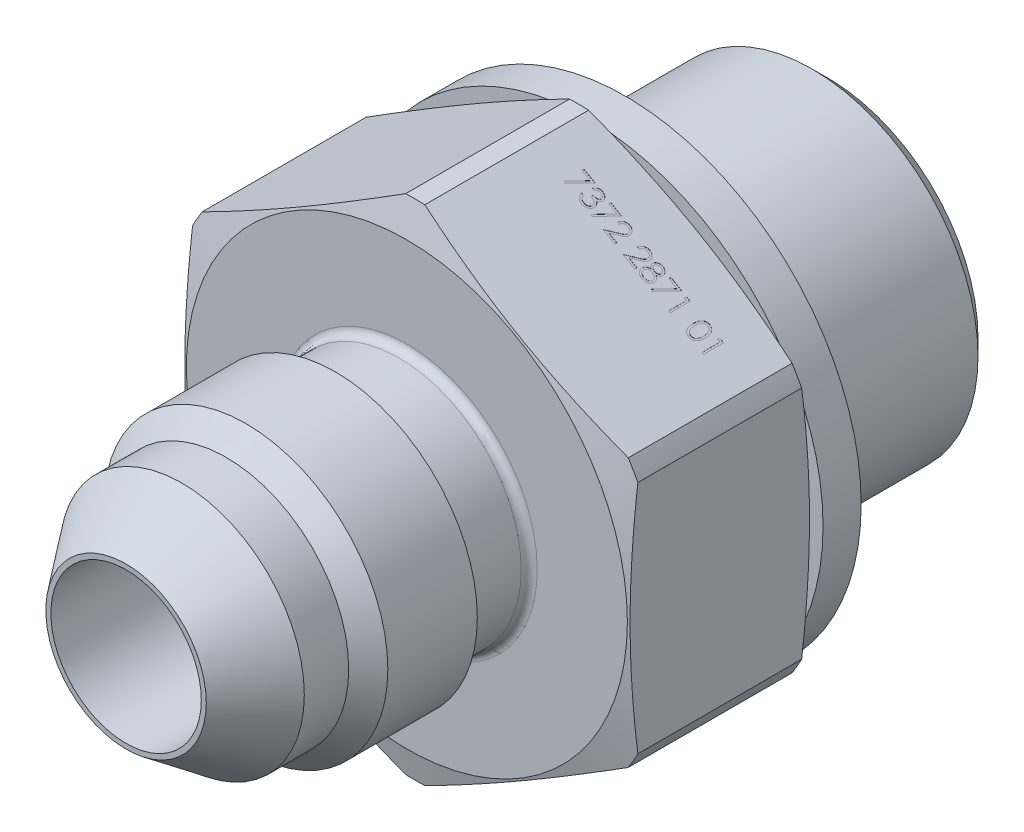
from build123d import *

# Parameters (mm, degrees)
SKETCH2_OUTSIDE_W  = 37.07
SKETCH2_OUTSIDE_H  = 37.07
EXTRUDE2_DEPTH     = 9
SKETCH3_R          = 11.75
SKETCH3_R_2        = 9.6
EXTRUDE3_DEPTH     = 1.9
CUT_EXTRUDE1_DEPTH = 0.01
SKETCH6_R          = 1.2


with BuildPart() as part:
    # Sketch1 → Revolve1 (revolve)
    with BuildSketch(Plane(origin=(0, 0, 0), x_dir=(0, 0, -1), z_dir=(1, 0, 0)), mode=Mode.PRIVATE) as revolve1_sk:
        with BuildLine():
            Line((0, 4), (2.786794125, 6.1))
            Line((2.786794125, 6.1), (5, 6.1))
            Line((5, 6.1), (5.975, 7.075))
            Line((5.975, 7.075), (10.437083488, 7.075))
            Line((10.437083488, 7.075), (11, 6.1))
            Line((11, 6.1), (13.6, 6.1))
            ThreePointArc((13.6, 6.1), (13.882842712, 6.217157288), (14, 6.5))
            Line((14, 6.5), (14, 10.99402544))
            Line((14, 10.99402544), (14.416922127, 12.55))
            Line((14.416922127, 12.55), (22.583077873, 12.55))
            Line((22.583077873, 12.55), (23, 10.99402544))
            Line((23, 10.99402544), (23, 7.25))
            Line((23, 7.25), (25.475, 7.25))
            Line((25.475, 7.25), (26.5, 8.275))
            Line((26.5, 8.275), (34.2, 8.275))
            Line((34.2, 8.275), (35, 7.475))
            Line((35, 7.475), (35, 7))
            Line((35, 7), (31.535898385, 5))
            Line((31.535898385, 5), (20.5, 5))
            Line((20.5, 5), (19.5, 3.335720518))
            Line((19.5, 3.335720518), (19.5, 1.5))
            Line((19.5, 1.5), (14.5, 1.5))
            Line((14.5, 1.5), (14.5, 3.75))
            Line((14.5, 3.75), (0, 3.75))
            Line((0, 3.75), (0, 4))
        make_face()
    revolve(revolve1_sk.sketch.rotate(Axis((0, 0, 0), (0, 0, -1)), 90), axis=Axis((0, 0, 0), (0, 0, -1)))

    # Sketch2 outside → Extrude2 (cut)
    with BuildSketch(Plane.XY.offset(-14)):
        Rectangle(SKETCH2_OUTSIDE_W, SKETCH2_OUTSIDE_H)
        Polygon((0, 12.817175976), (-11.1, 6.408587988), (-11.1, -6.408587988), (0, -12.817175976), (11.1, -6.408587988), (11.1, 6.408587988), align=None, mode=Mode.SUBTRACT)
    extrude(amount=-EXTRUDE2_DEPTH, mode=Mode.SUBTRACT)

    # Sketch5 → Cut-Extrude1 (cut)
    # profile 1 of 10: a face of its own
    with BuildSketch(Plane(origin=(5.55, 9.612881982, 0), x_dir=(0.8660254037844386, -0.5000000000000001, 0), z_dir=(0.5000000000000001, 0.8660254037844386, 0))):
        Polygon((-4.063128825, 20.809494123), (-3.44774421, 20.809494123), (-3.973385235, 19.783853097), (-4.050909274, 19.826521366), (-3.599787479, 20.70693002), (-4.063128825, 20.70693002), align=None)
    # profile 2 of 10: a face of its own
    with BuildSketch(Plane(origin=(5.55, 9.612881982, 0), x_dir=(0.8660254037844386, -0.5000000000000001, 0), z_dir=(0.5000000000000001, 0.8660254037844386, 0))):
        with BuildLine():
            Line((-3.229795492, 20.578724892), (-3.319539081, 20.578724892))
            add(Edge.make_bspline(
                [(-3.319539081, 20.578724892), (-3.317107781, 20.588791316), (-3.312354788, 20.608470352), (-3.302441196, 20.636586712), (-3.291641409, 20.663193432), (-3.278673093, 20.68779231), (-3.264527735, 20.710877711), (-3.248321243, 20.731926033), (-3.230801322, 20.751472594), (-3.211422765, 20.768819233), (-3.19110029, 20.784527156), (-3.169547542, 20.79792003), (-3.147198144, 20.809441216), (-3.123897248, 20.818932711), (-3.099575485, 20.826082861), (-3.074452736, 20.831270519), (-3.048463164, 20.834639409), (-3.030820995, 20.834968198), (-3.021862799, 20.835135149)],
                knots=[0, 0, 0, 0, 1.162005537, 2.271625781, 3.343758855, 4.383309926, 5.390229558, 6.379919256, 7.361854164, 8.333198761, 9.295911338, 10.242430842, 11.177959212, 12.116337295, 13.062827104, 14.020064771, 14.994644689, 16, 16, 16, 16], degree=3))
            add(Edge.make_bspline(
                [(-3.021862799, 20.835135149), (-3.008810587, 20.834741083), (-2.98299087, 20.833961547), (-2.945058571, 20.826843136), (-2.90847948, 20.815578813), (-2.87365398, 20.800014891), (-2.841305857, 20.780818516), (-2.812524089, 20.757971448), (-2.7876988, 20.731914505), (-2.766871835, 20.703133772), (-2.750564693, 20.672375055), (-2.738540014, 20.640717867), (-2.731219534, 20.608237304), (-2.730270804, 20.586306653), (-2.729795492, 20.575319443)],
                knots=[0, 0, 0, 0, 1.083050992, 2.142477498, 3.193116406, 4.255571735, 5.30263384, 6.308962982, 7.297363603, 8.282367274, 9.249857812, 10.179914175, 11.08814088, 12, 12, 12, 12], degree=3))
            add(Edge.make_bspline(
                [(-2.729795492, 20.575319443), (-2.730127946, 20.564746073), (-2.730778508, 20.544055629), (-2.736302424, 20.513849487), (-2.745598499, 20.485380459), (-2.758475574, 20.458528698), (-2.775144589, 20.433464458), (-2.795336788, 20.410131346), (-2.819194691, 20.388425873), (-2.837274388, 20.375991738), (-2.846582351, 20.369590277)],
                knots=[0, 0, 0, 0, 1.024540389, 2.004866551, 2.965041327, 3.920577974, 4.882998113, 5.874504559, 6.905732034, 8, 8, 8, 8], degree=3))
            add(Edge.make_bspline(
                [(-2.846582351, 20.369590277), (-2.835944706, 20.364453656), (-2.814868457, 20.354276526), (-2.786139734, 20.334317738), (-2.760060341, 20.311273067), (-2.745516421, 20.293289452), (-2.738208953, 20.284253738)],
                knots=[0, 0, 0, 0, 1.015518401, 2.012035669, 3.001164323, 4, 4, 4, 4], degree=3))
            add(Edge.make_bspline(
                [(-2.738208953, 20.284253738), (-2.733397141, 20.277665809), (-2.723852314, 20.264597833), (-2.712070733, 20.243587426), (-2.701382414, 20.222344143), (-2.69305378, 20.200298598), (-2.686604104, 20.177706309), (-2.681993809, 20.154528481), (-2.679129769, 20.130746189), (-2.678719611, 20.114656909), (-2.67851344, 20.106569443)],
                knots=[0, 0, 0, 0, 1.025084078, 2.033381695, 3.024893161, 4.013698104, 4.991890475, 5.976764909, 6.982997093, 8, 8, 8, 8], degree=3))
            add(Edge.make_bspline(
                [(-2.67851344, 20.106569443), (-2.679026158, 20.092566666), (-2.680049182, 20.064627008), (-2.689193203, 20.023348516), (-2.703368415, 19.982998373), (-2.723498968, 19.944405562), (-2.748032542, 19.908296881), (-2.777220349, 19.875989364), (-2.810730751, 19.848218335), (-2.848103794, 19.825015412), (-2.888594402, 19.806467435), (-2.931901714, 19.793593879), (-2.977401729, 19.785209308), (-3.008603814, 19.784310203), (-3.024466966, 19.783853097)],
                knots=[0, 0, 0, 0, 0.955779014, 1.907060117, 2.875433937, 3.871313158, 4.872415639, 5.851225146, 6.836215519, 7.83643374, 8.849228613, 9.86973379, 10.916971861, 12, 12, 12, 12], degree=3))
            add(Edge.make_bspline(
                [(-3.024466966, 19.783853097), (-3.035158195, 19.784101158), (-3.056194967, 19.784589259), (-3.087121681, 19.787926003), (-3.116642167, 19.79402029), (-3.144796338, 19.802221234), (-3.171609205, 19.812618875), (-3.19699895, 19.825567074), (-3.221121776, 19.840798932), (-3.243750048, 19.858494243), (-3.264881067, 19.878288911), (-3.283953274, 19.900534343), (-3.301284644, 19.924819315), (-3.316411112, 19.951425903), (-3.33002167, 19.980010262), (-3.341216229, 20.010938404), (-3.351069248, 20.043933839), (-3.355650238, 20.066927479), (-3.35800062, 20.078724892)],
                knots=[0, 0, 0, 0, 1.048658725, 2.063410685, 3.046034179, 4.001477787, 4.936774919, 5.862367409, 6.792675028, 7.730719943, 8.675894397, 9.627829632, 10.600096036, 11.597688215, 12.626045268, 13.701542398, 14.82072376, 16, 16, 16, 16], degree=3))
            Line((-3.35800062, 20.078724892), (-3.26825703, 20.078724892))
            add(Edge.make_bspline(
                [(-3.26825703, 20.078724892), (-3.265918947, 20.071025174), (-3.261371172, 20.056048554), (-3.253629944, 20.034494181), (-3.244810437, 20.014734737), (-3.235349135, 19.996625273), (-3.225412436, 19.979987444), (-3.214293886, 19.965261196), (-3.202816987, 19.951799709), (-3.194165744, 19.944215535), (-3.18993171, 19.940503738)],
                knots=[0, 0, 0, 0, 1.198163088, 2.33053128, 3.407730985, 4.417276592, 5.372219308, 6.28897303, 7.162600585, 8, 8, 8, 8], degree=3))
            add(Edge.make_bspline(
                [(-3.18993171, 19.940503738), (-3.184332688, 19.936187071), (-3.173151927, 19.927567062), (-3.154932432, 19.916566597), (-3.135771036, 19.907034876), (-3.115252558, 19.89975382), (-3.093819766, 19.893588774), (-3.071126233, 19.88955434), (-3.047372171, 19.886786291), (-3.03115281, 19.886542025), (-3.022864402, 19.8864172)],
                knots=[0, 0, 0, 0, 0.946170439, 1.889420265, 2.845303464, 3.807233317, 4.801018734, 5.828864929, 6.890507805, 8, 8, 8, 8], degree=3))
            add(Edge.make_bspline(
                [(-3.022864402, 19.8864172), (-3.013506258, 19.886593173), (-2.995207216, 19.886937273), (-2.968505828, 19.89010176), (-2.9431037, 19.89471045), (-2.919282864, 19.901828445), (-2.896731291, 19.910622974), (-2.875765105, 19.921665375), (-2.856109075, 19.93462101), (-2.838014959, 19.949346484), (-2.821744814, 19.965466911), (-2.807419239, 19.982327789), (-2.795240764, 19.999858026), (-2.785416884, 20.018154632), (-2.777659584, 20.03714184), (-2.77237867, 20.056872934), (-2.768706808, 20.077186439), (-2.768407776, 20.090994716), (-2.76825703, 20.097955661)],
                knots=[0, 0, 0, 0, 1.217147791, 2.380027433, 3.494444702, 4.572153297, 5.609568379, 6.639424714, 7.649109417, 8.668170816, 9.669597737, 10.625200337, 11.543417969, 12.441394052, 13.322311151, 14.205496177, 15.095365482, 16, 16, 16, 16], degree=3))
            add(Edge.make_bspline(
                [(-2.76825703, 20.097955661), (-2.768694259, 20.107273187), (-2.769566541, 20.125861875), (-2.776226136, 20.153209753), (-2.787180097, 20.1795593), (-2.8025151, 20.204460954), (-2.821182451, 20.227539783), (-2.843000996, 20.248131635), (-2.868151918, 20.26512309), (-2.891300452, 20.276862706), (-2.911804783, 20.284873299), (-2.929352035, 20.290209003), (-2.948996779, 20.29472719), (-2.97050145, 20.298930696), (-2.994028084, 20.302508224), (-3.019551066, 20.3054916), (-3.047075569, 20.307878755), (-3.066130188, 20.308944782), (-3.075949338, 20.309494123)],
                knots=[0, 0, 0, 0, 1.07054697, 2.135767047, 3.216561865, 4.33974944, 5.486079747, 6.621378074, 7.775625952, 8.963672916, 9.598146892, 10.304877434, 11.070270905, 11.915000392, 12.823868403, 13.805723172, 14.86925407, 16, 16, 16, 16], degree=3))
            Line((-3.075949338, 20.309494123), (-3.075949338, 20.412058225))
            add(Edge.make_bspline(
                [(-3.075949338, 20.412058225), (-3.063577576, 20.412268169), (-3.039344334, 20.412679398), (-3.003945961, 20.417653115), (-2.970096444, 20.424533295), (-2.938545946, 20.435071921), (-2.909789171, 20.447312006), (-2.884840713, 20.461555494), (-2.864050099, 20.47738828), (-2.847518365, 20.49505474), (-2.835081442, 20.514001896), (-2.825988072, 20.533749512), (-2.82061655, 20.554470673), (-2.819899502, 20.568612006), (-2.819539081, 20.575720084)],
                knots=[0, 0, 0, 0, 1.321986639, 2.589447074, 3.816329219, 5.01088745, 6.139805852, 7.153945165, 8.075214402, 8.924034688, 9.728124013, 10.488707548, 11.240355623, 12, 12, 12, 12], degree=3))
            add(Edge.make_bspline(
                [(-2.819539081, 20.575720084), (-2.819657484, 20.580942297), (-2.819893042, 20.591331642), (-2.822863693, 20.606510233), (-2.827327704, 20.621224789), (-2.83346477, 20.635412735), (-2.841679112, 20.64897567), (-2.851509394, 20.662029227), (-2.863214566, 20.674498878), (-2.876627551, 20.686121827), (-2.891030923, 20.697198752), (-2.906816573, 20.706602648), (-2.923508538, 20.714644094), (-2.941125296, 20.721275381), (-2.959724019, 20.726263749), (-2.979217321, 20.729845418), (-2.999642374, 20.732084748), (-3.013577154, 20.732407152), (-3.020660876, 20.732571046)],
                knots=[0, 0, 0, 0, 0.884392785, 1.759457502, 2.611959086, 3.489218968, 4.37281399, 5.2945488, 6.255912374, 7.266815255, 8.301784654, 9.332968512, 10.37626691, 11.440494194, 12.520033166, 13.637162961, 14.798855837, 16, 16, 16, 16], degree=3))
            add(Edge.make_bspline(
                [(-3.020660876, 20.732571046), (-3.032047067, 20.732173514), (-3.054286946, 20.731397041), (-3.086348351, 20.724596181), (-3.116153875, 20.7137453), (-3.138936351, 20.700793008), (-3.155759944, 20.68800717), (-3.167781926, 20.676840774), (-3.179587786, 20.664431396), (-3.190400837, 20.650014717), (-3.201336259, 20.634567063), (-3.211291848, 20.617303154), (-3.220966045, 20.598673327), (-3.226795345, 20.585503145), (-3.229795492, 20.578724892)],
                knots=[0, 0, 0, 0, 1.472543308, 2.876219568, 4.221790263, 5.565193594, 6.249813518, 6.953379497, 7.687249741, 8.463570142, 9.283606569, 10.136032583, 11.040678096, 12, 12, 12, 12], degree=3))
        make_face()
    # profile 3 of 10: a face of its own
    with BuildSketch(Plane(origin=(5.55, 9.612881982, 0), x_dir=(0.8660254037844386, -0.5000000000000001, 0), z_dir=(0.5000000000000001, 0.8660254037844386, 0))):
        Polygon((-2.524667286, 20.809494123), (-1.909282671, 20.809494123), (-2.434923697, 19.783853097), (-2.512447735, 19.826521366), (-2.06132594, 20.70693002), (-2.524667286, 20.70693002), align=None)
    # profile 4 of 10: a face of its own
    with BuildSketch(Plane(origin=(5.55, 9.612881982, 0), x_dir=(0.8660254037844386, -0.5000000000000001, 0), z_dir=(0.5000000000000001, 0.8660254037844386, 0))):
        with BuildLine():
            Line((-1.691333953, 20.501801815), (-1.781077543, 20.501801815))
            add(Edge.make_bspline(
                [(-1.781077543, 20.501801815), (-1.780492642, 20.513707783), (-1.779343912, 20.537090787), (-1.773964401, 20.571183332), (-1.766267008, 20.603770417), (-1.755383735, 20.634590393), (-1.741867656, 20.663915766), (-1.725659076, 20.691630056), (-1.706460833, 20.717627539), (-1.684687481, 20.741667208), (-1.661039298, 20.7637208), (-1.635523316, 20.782765155), (-1.608710451, 20.798855918), (-1.580682051, 20.812307702), (-1.55112189, 20.822404801), (-1.520298216, 20.829896698), (-1.488075606, 20.834404225), (-1.466121314, 20.834888735), (-1.454955748, 20.835135149)],
                knots=[0, 0, 0, 0, 1.10065271, 2.161652631, 3.183658789, 4.190468796, 5.17591951, 6.163126047, 7.15150782, 8.156236427, 9.156009102, 10.134482811, 11.092018607, 12.041330605, 13.001268258, 13.972401359, 14.968799086, 16, 16, 16, 16], degree=3))
            add(Edge.make_bspline(
                [(-1.454955748, 20.835135149), (-1.443990584, 20.834878447), (-1.422444428, 20.834374037), (-1.390998139, 20.830042314), (-1.361061769, 20.823257859), (-1.332693835, 20.813739169), (-1.306120674, 20.800943618), (-1.281142661, 20.785572893), (-1.25746243, 20.767795798), (-1.236146206, 20.746866137), (-1.216572469, 20.724522599), (-1.19968611, 20.700668912), (-1.185225206, 20.676031973), (-1.173171584, 20.650423916), (-1.164298401, 20.623603622), (-1.15756177, 20.595961564), (-1.153753938, 20.567211618), (-1.153169531, 20.547752602), (-1.152872415, 20.537859507)],
                knots=[0, 0, 0, 0, 1.111607364, 2.184268762, 3.212621178, 4.221274766, 5.211760367, 6.196651075, 7.1921475, 8.207485113, 9.220403448, 10.201281604, 11.166441695, 12.114753415, 13.065576456, 14.026450734, 14.996634279, 16, 16, 16, 16], degree=3))
            add(Edge.make_bspline(
                [(-1.152872415, 20.537859507), (-1.153354313, 20.523930991), (-1.154309654, 20.496318382), (-1.16255414, 20.455688566), (-1.175291882, 20.416287121), (-1.190741319, 20.38457882), (-1.206347196, 20.35915685), (-1.220112851, 20.338038096), (-1.236584952, 20.315516263), (-1.255612785, 20.291364517), (-1.276909301, 20.265508983), (-1.300627777, 20.23793905), (-1.326949403, 20.208947534), (-1.345423169, 20.189145873), (-1.354995812, 20.178885149)],
                knots=[0, 0, 0, 0, 1.184203166, 2.347625244, 3.513805382, 4.700623107, 5.337941753, 6.051866363, 6.845199593, 7.711357327, 8.668078039, 9.695487809, 10.805859518, 12, 12, 12, 12], degree=3))
            Line((-1.354995812, 20.178885149), (-1.605196133, 19.912058225))
            Line((-1.605196133, 19.912058225), (-1.140051902, 19.912058225))
            Line((-1.140051902, 19.912058225), (-1.140051902, 19.809494123))
            Line((-1.140051902, 19.809494123), (-1.819539081, 19.809494123))
            Line((-1.819539081, 19.809494123), (-1.431718569, 20.223356302))
            add(Edge.make_bspline(
                [(-1.431718569, 20.223356302), (-1.422276315, 20.233212961), (-1.404139679, 20.252145586), (-1.378487514, 20.279786432), (-1.355447803, 20.305429158), (-1.334871405, 20.329025315), (-1.317204689, 20.350920048), (-1.301526909, 20.370404249), (-1.288965311, 20.388334092), (-1.275332341, 20.409117125), (-1.262128346, 20.434492072), (-1.250781959, 20.465501698), (-1.243863431, 20.49742377), (-1.243033478, 20.518995781), (-1.242616004, 20.529846687)],
                knots=[0, 0, 0, 0, 1.329631726, 2.553950428, 3.673215718, 4.687767853, 5.603093632, 6.413772471, 7.123043292, 7.734684054, 8.834405432, 9.900288307, 10.943827018, 12, 12, 12, 12], degree=3))
            add(Edge.make_bspline(
                [(-1.242616004, 20.529846687), (-1.242797645, 20.536669944), (-1.243155624, 20.550117272), (-1.246314966, 20.569833203), (-1.251089396, 20.588851722), (-1.257930899, 20.607231327), (-1.266961396, 20.624787228), (-1.27795379, 20.641540794), (-1.290636665, 20.657737641), (-1.305308457, 20.672924297), (-1.321426034, 20.686833213), (-1.338452962, 20.69915438), (-1.356467278, 20.709451269), (-1.375393027, 20.717892268), (-1.395177447, 20.724513806), (-1.415858802, 20.729101971), (-1.43737995, 20.731982681), (-1.452075234, 20.732372445), (-1.45956312, 20.732571046)],
                knots=[0, 0, 0, 0, 0.991446411, 1.95395049, 2.89581595, 3.838931463, 4.798493298, 5.75982156, 6.748411868, 7.785213223, 8.824556874, 9.840280684, 10.836137867, 11.835679398, 12.848801643, 13.863922112, 14.911575587, 16, 16, 16, 16], degree=3))
            add(Edge.make_bspline(
                [(-1.45956312, 20.732571046), (-1.467383358, 20.732366751), (-1.482741014, 20.73196555), (-1.505289309, 20.729159074), (-1.526799531, 20.724317405), (-1.547325789, 20.717695498), (-1.566902814, 20.70927877), (-1.585435398, 20.698795415), (-1.602881937, 20.686285845), (-1.61927523, 20.672102829), (-1.634379224, 20.656312086), (-1.64764976, 20.638709239), (-1.659245192, 20.619615692), (-1.669362116, 20.599082963), (-1.677578028, 20.57692474), (-1.683856071, 20.553219682), (-1.688823741, 20.528070716), (-1.690483318, 20.510703549), (-1.691333953, 20.501801815)],
                knots=[0, 0, 0, 0, 1.031018746, 2.02475058, 2.990194455, 3.934040569, 4.864654155, 5.795059489, 6.735614925, 7.690564532, 8.649604399, 9.611025574, 10.590972636, 11.591080095, 12.624614302, 13.701020113, 14.821632451, 16, 16, 16, 16], degree=3))
        make_face()
    # profile 5 of 10: a face of its own
    with BuildSketch(Plane(origin=(5.55, 9.612881982, 0), x_dir=(0.8660254037844386, -0.5000000000000001, 0), z_dir=(0.5000000000000001, 0.8660254037844386, 0))):
        with BuildLine():
            Line((-0.537487799, 20.501801815), (-0.627231389, 20.501801815))
            add(Edge.make_bspline(
                [(-0.627231389, 20.501801815), (-0.626646488, 20.513707783), (-0.625497758, 20.537090787), (-0.620118247, 20.571183332), (-0.612420854, 20.603770417), (-0.601537581, 20.634590393), (-0.588021502, 20.663915766), (-0.571812923, 20.691630056), (-0.55261468, 20.717627539), (-0.530841327, 20.741667208), (-0.507193144, 20.7637208), (-0.481677162, 20.782765155), (-0.454864297, 20.798855918), (-0.426835897, 20.812307702), (-0.397275736, 20.822404801), (-0.366452062, 20.829896698), (-0.334229452, 20.834404225), (-0.31227516, 20.834888735), (-0.301109594, 20.835135149)],
                knots=[0, 0, 0, 0, 1.10065271, 2.161652631, 3.183658789, 4.190468796, 5.17591951, 6.163126047, 7.15150782, 8.156236427, 9.156009102, 10.134482811, 11.092018607, 12.041330605, 13.001268258, 13.972401359, 14.968799086, 16, 16, 16, 16], degree=3))
            add(Edge.make_bspline(
                [(-0.301109594, 20.835135149), (-0.29014443, 20.834878447), (-0.268598275, 20.834374037), (-0.237151985, 20.830042314), (-0.207215615, 20.823257859), (-0.178847682, 20.813739169), (-0.15227452, 20.800943618), (-0.127296507, 20.785572893), (-0.103616276, 20.767795798), (-0.082300052, 20.746866137), (-0.062726315, 20.724522599), (-0.045839956, 20.700668912), (-0.031379053, 20.676031973), (-0.01932543, 20.650423916), (-0.010452247, 20.623603622), (-0.003715616, 20.595961564), (9.2216e-05, 20.567211618), (0.000676623, 20.547752602), (0.000973739, 20.537859507)],
                knots=[0, 0, 0, 0, 1.111607364, 2.184268762, 3.212621178, 4.221274766, 5.211760367, 6.196651075, 7.1921475, 8.207485113, 9.220403448, 10.201281604, 11.166441695, 12.114753415, 13.065576456, 14.026450734, 14.996634279, 16, 16, 16, 16], degree=3))
            add(Edge.make_bspline(
                [(0.000973739, 20.537859507), (0.000491841, 20.523930991), (-0.0004635, 20.496318382), (-0.008707986, 20.455688566), (-0.021445728, 20.416287121), (-0.036895165, 20.38457882), (-0.052501042, 20.35915685), (-0.066266698, 20.338038096), (-0.082738798, 20.315516263), (-0.101766631, 20.291364517), (-0.123063147, 20.265508983), (-0.146781623, 20.23793905), (-0.173103249, 20.208947534), (-0.191577015, 20.189145873), (-0.201149658, 20.178885149)],
                knots=[0, 0, 0, 0, 1.184203166, 2.347625244, 3.513805382, 4.700623107, 5.337941753, 6.051866363, 6.845199593, 7.711357327, 8.668078039, 9.695487809, 10.805859518, 12, 12, 12, 12], degree=3))
            Line((-0.201149658, 20.178885149), (-0.451349979, 19.912058225))
            Line((-0.451349979, 19.912058225), (0.013794252, 19.912058225))
            Line((0.013794252, 19.912058225), (0.013794252, 19.809494123))
            Line((0.013794252, 19.809494123), (-0.665692927, 19.809494123))
            Line((-0.665692927, 19.809494123), (-0.277872415, 20.223356302))
            add(Edge.make_bspline(
                [(-0.277872415, 20.223356302), (-0.268430161, 20.233212961), (-0.250293525, 20.252145586), (-0.22464136, 20.279786432), (-0.201601649, 20.305429158), (-0.181025251, 20.329025315), (-0.163358535, 20.350920048), (-0.147680755, 20.370404249), (-0.135119157, 20.388334092), (-0.121486187, 20.409117125), (-0.108282193, 20.434492072), (-0.096935805, 20.465501698), (-0.090017277, 20.49742377), (-0.089187324, 20.518995781), (-0.088769851, 20.529846687)],
                knots=[0, 0, 0, 0, 1.329631726, 2.553950428, 3.673215718, 4.687767853, 5.603093632, 6.413772471, 7.123043292, 7.734684054, 8.834405432, 9.900288307, 10.943827018, 12, 12, 12, 12], degree=3))
            add(Edge.make_bspline(
                [(-0.088769851, 20.529846687), (-0.088951491, 20.536669944), (-0.08930947, 20.550117272), (-0.092468812, 20.569833203), (-0.097243243, 20.588851722), (-0.104084745, 20.607231327), (-0.113115242, 20.624787228), (-0.124107636, 20.641540794), (-0.136790512, 20.657737641), (-0.151462303, 20.672924297), (-0.16757988, 20.686833213), (-0.184606808, 20.69915438), (-0.202621124, 20.709451269), (-0.221546873, 20.717892268), (-0.241331293, 20.724513806), (-0.262012649, 20.729101971), (-0.283533796, 20.731982681), (-0.298229081, 20.732372445), (-0.305716966, 20.732571046)],
                knots=[0, 0, 0, 0, 0.991446411, 1.95395049, 2.89581595, 3.838931463, 4.798493298, 5.75982156, 6.748411868, 7.785213223, 8.824556874, 9.840280684, 10.836137867, 11.835679398, 12.848801643, 13.863922112, 14.911575587, 16, 16, 16, 16], degree=3))
            add(Edge.make_bspline(
                [(-0.305716966, 20.732571046), (-0.313537204, 20.732366751), (-0.32889486, 20.73196555), (-0.351443155, 20.729159074), (-0.372953377, 20.724317405), (-0.393479635, 20.717695498), (-0.41305666, 20.70927877), (-0.431589244, 20.698795415), (-0.449035784, 20.686285845), (-0.465429076, 20.672102829), (-0.48053307, 20.656312086), (-0.493803606, 20.638709239), (-0.505399039, 20.619615692), (-0.515515962, 20.599082963), (-0.523731874, 20.57692474), (-0.530009917, 20.553219682), (-0.534977587, 20.528070716), (-0.536637165, 20.510703549), (-0.537487799, 20.501801815)],
                knots=[0, 0, 0, 0, 1.031018746, 2.02475058, 2.990194455, 3.934040569, 4.864654155, 5.795059489, 6.735614925, 7.690564532, 8.649604399, 9.611025574, 10.590972636, 11.591080095, 12.624614302, 13.701020113, 14.821632451, 16, 16, 16, 16], degree=3))
        make_face()
    # profile 6 of 10: a face of its own
    with BuildSketch(Plane(origin=(5.55, 9.612881982, 0), x_dir=(0.8660254037844386, -0.5000000000000001, 0), z_dir=(0.5000000000000001, 0.8660254037844386, 0))):
        with BuildLine():
            add(Edge.make_bspline(
                [(0.589715726, 20.366585469), (0.597901026, 20.362317482), (0.613865093, 20.353993481), (0.636601438, 20.340590387), (0.65738001, 20.326464397), (0.676777313, 20.312282723), (0.694452556, 20.297502251), (0.710208103, 20.282064207), (0.724433137, 20.266353937), (0.736840789, 20.250105411), (0.747754171, 20.233361797), (0.75718621, 20.216079147), (0.765248268, 20.198295338), (0.771637679, 20.179816243), (0.776901048, 20.160913311), (0.780522649, 20.14134246), (0.78247034, 20.121232648), (0.782838573, 20.107641705), (0.783025021, 20.100760149)],
                knots=[0, 0, 0, 0, 1.272397273, 2.481599622, 3.635517121, 4.734568067, 5.792894095, 6.808321871, 7.773003508, 8.711915296, 9.623354172, 10.525449501, 11.423591555, 12.311487226, 13.218079475, 14.126165749, 15.051214107, 16, 16, 16, 16], degree=3))
            add(Edge.make_bspline(
                [(0.783025021, 20.100760149), (0.782804615, 20.091132225), (0.782368349, 20.072074952), (0.778568354, 20.043947491), (0.772878932, 20.016629839), (0.7645705, 19.990127985), (0.753795245, 19.964588164), (0.740516149, 19.939988514), (0.725484376, 19.915925854), (0.713412308, 19.901120311), (0.707303867, 19.893628738)],
                knots=[0, 0, 0, 0, 1.025265484, 2.029385089, 3.018602448, 3.995076438, 4.983346944, 5.966715145, 6.97116228, 8, 8, 8, 8], degree=3))
            add(Edge.make_bspline(
                [(0.707303867, 19.893628738), (0.699350589, 19.88488766), (0.683542313, 19.867513519), (0.656461477, 19.844956145), (0.626740938, 19.825999175), (0.594495701, 19.810550062), (0.559811957, 19.798525531), (0.522697099, 19.789884812), (0.483078769, 19.784935546), (0.455848635, 19.784220121), (0.441879188, 19.783853097)],
                knots=[0, 0, 0, 0, 0.954267603, 1.896743057, 2.838368354, 3.796610408, 4.779680527, 5.799409237, 6.871065594, 8, 8, 8, 8], degree=3))
            add(Edge.make_bspline(
                [(0.441879188, 19.783853097), (0.428446791, 19.784182377), (0.402308711, 19.784823121), (0.364263604, 19.789164387), (0.328799869, 19.796772349), (0.295711307, 19.807185095), (0.265197395, 19.820730874), (0.23734508, 19.837590419), (0.211752516, 19.857085117), (0.189196381, 19.879774854), (0.169171111, 19.904077103), (0.151580239, 19.929148992), (0.136959074, 19.954992808), (0.124579904, 19.981223199), (0.115103326, 20.008207814), (0.108539837, 20.035807818), (0.104371462, 20.063975001), (0.103816852, 20.082984045), (0.103537842, 20.092547007)],
                knots=[0, 0, 0, 0, 1.256902934, 2.445805442, 3.576955095, 4.645999104, 5.686449165, 6.692658513, 7.68621702, 8.689161843, 9.678783111, 10.630372946, 11.551080876, 12.453998257, 13.34127905, 14.221779781, 15.105423033, 16, 16, 16, 16], degree=3))
            add(Edge.make_bspline(
                [(0.103537842, 20.092547007), (0.103702951, 20.09956392), (0.104029264, 20.113431814), (0.106287792, 20.133920194), (0.109918781, 20.153861947), (0.114850054, 20.173330731), (0.121533205, 20.192184808), (0.129602386, 20.210513515), (0.139011515, 20.228337543), (0.149891848, 20.245754367), (0.162549569, 20.262519942), (0.17688204, 20.278918797), (0.193175717, 20.294696473), (0.211249334, 20.310045738), (0.230896345, 20.325238873), (0.252627068, 20.339454796), (0.27586543, 20.353699928), (0.292381261, 20.362216593), (0.300853547, 20.366585469)],
                knots=[0, 0, 0, 0, 0.941657376, 1.861047343, 2.762797495, 3.66048619, 4.553285746, 5.444104102, 6.34607688, 7.256116206, 8.197091036, 9.162375105, 10.176350973, 11.237807142, 12.343728897, 13.50695164, 14.721116704, 16, 16, 16, 16], degree=3))
            add(Edge.make_bspline(
                [(0.300853547, 20.366585469), (0.289256011, 20.372909689), (0.266799936, 20.385155148), (0.23706581, 20.407654235), (0.211525632, 20.432022182), (0.190881427, 20.458773552), (0.174632219, 20.487072659), (0.163484046, 20.516742446), (0.155942194, 20.547232764), (0.1551951, 20.568063106), (0.154819893, 20.578524572)],
                knots=[0, 0, 0, 0, 1.166880483, 2.259407225, 3.286803203, 4.280235371, 5.237608625, 6.161067461, 7.076446754, 8, 8, 8, 8], degree=3))
            add(Edge.make_bspline(
                [(0.154819893, 20.578524572), (0.155287157, 20.589181017), (0.156226439, 20.61060233), (0.163821674, 20.642489794), (0.176198836, 20.673808813), (0.193033406, 20.704407588), (0.214001182, 20.733250506), (0.239157338, 20.759119348), (0.267901137, 20.781779772), (0.300089099, 20.800801535), (0.334728024, 20.816282581), (0.371275373, 20.82696213), (0.409094371, 20.833943878), (0.434836577, 20.83473435), (0.447888803, 20.835135149)],
                knots=[0, 0, 0, 0, 0.888701115, 1.786444228, 2.72001202, 3.692817113, 4.693886446, 5.687152267, 6.695133018, 7.739871481, 8.800368666, 9.853104506, 10.91144658, 12, 12, 12, 12], degree=3))
            add(Edge.make_bspline(
                [(0.447888803, 20.835135149), (0.460604179, 20.834721908), (0.485677451, 20.833907044), (0.522533059, 20.827110793), (0.55779731, 20.815759501), (0.591348595, 20.800360295), (0.622586272, 20.781392597), (0.650186932, 20.758420919), (0.674567669, 20.73266619), (0.694734639, 20.703832018), (0.711352607, 20.67335082), (0.722924293, 20.641458671), (0.730339143, 20.608844654), (0.73127439, 20.586776653), (0.73174297, 20.575720084)],
                knots=[0, 0, 0, 0, 1.072916533, 2.115669174, 3.151510826, 4.193348718, 5.225979165, 6.227137561, 7.216255879, 8.211077061, 9.189680878, 10.138522389, 11.067357538, 12, 12, 12, 12], degree=3))
            add(Edge.make_bspline(
                [(0.73174297, 20.575720084), (0.731333095, 20.564869609), (0.730528125, 20.543559892), (0.723756714, 20.512495172), (0.71235291, 20.483403161), (0.696783149, 20.455953746), (0.676490153, 20.430644747), (0.651744801, 20.407154327), (0.622744378, 20.385289519), (0.600955554, 20.372950557), (0.589715726, 20.366585469)],
                knots=[0, 0, 0, 0, 0.975232327, 1.915300861, 2.843280834, 3.77672583, 4.742871857, 5.749627742, 6.839139064, 8, 8, 8, 8], degree=3))
        make_face()
        with BuildLine():
            add(Edge.make_bspline(
                [(0.44288079, 20.732571046), (0.435866274, 20.73238492), (0.422142814, 20.732020776), (0.402020337, 20.730118309), (0.382885375, 20.72641739), (0.364538003, 20.721492044), (0.347229771, 20.714838333), (0.330725612, 20.707011187), (0.315306415, 20.697495168), (0.300786043, 20.68682054), (0.287714393, 20.67507971), (0.276113093, 20.662847219), (0.266476489, 20.649882821), (0.258293315, 20.636509004), (0.252355738, 20.62232884), (0.247908794, 20.607777075), (0.244902682, 20.592669822), (0.244677428, 20.582345105), (0.244563483, 20.577122328)],
                knots=[0, 0, 0, 0, 1.203892937, 2.355340988, 3.463153438, 4.544400666, 5.610487187, 6.640501085, 7.674077295, 8.714426146, 9.728707835, 10.68524104, 11.601827946, 12.495867327, 13.368432065, 14.231010473, 15.105153427, 16, 16, 16, 16], degree=3))
            add(Edge.make_bspline(
                [(0.244563483, 20.577122328), (0.244759873, 20.571899325), (0.245147969, 20.561577922), (0.248149434, 20.546336246), (0.252622821, 20.531358635), (0.259665868, 20.517001232), (0.268113399, 20.502765986), (0.278539535, 20.489008676), (0.290964971, 20.475681423), (0.304972811, 20.462897583), (0.320233251, 20.450926508), (0.33640012, 20.44053417), (0.353270518, 20.43183871), (0.370671109, 20.424601737), (0.388779237, 20.418976041), (0.407483943, 20.414984999), (0.426788373, 20.412504429), (0.439868539, 20.412208137), (0.44648656, 20.412058225)],
                knots=[0, 0, 0, 0, 0.873023192, 1.725219244, 2.590779336, 3.480155217, 4.391973325, 5.357036234, 6.360879153, 7.436073238, 8.526419356, 9.601555421, 10.645666583, 11.697338044, 12.750135903, 13.812665442, 14.89329948, 16, 16, 16, 16], degree=3))
            add(Edge.make_bspline(
                [(0.44648656, 20.412058225), (0.454986589, 20.412307616), (0.471902694, 20.412803934), (0.496839646, 20.417418555), (0.521086116, 20.424677389), (0.544382946, 20.434608808), (0.566127113, 20.447073911), (0.58550999, 20.46199763), (0.602366245, 20.479035372), (0.616520705, 20.497921897), (0.627494947, 20.51802235), (0.63603832, 20.538193863), (0.641027239, 20.558651643), (0.641677973, 20.57235649), (0.64199938, 20.579125533)],
                knots=[0, 0, 0, 0, 1.076279235, 2.141928126, 3.20205304, 4.278698113, 5.344010996, 6.36967002, 7.368914609, 8.37248503, 9.349703398, 10.264243087, 11.142681841, 12, 12, 12, 12], degree=3))
            add(Edge.make_bspline(
                [(0.64199938, 20.579125533), (0.641847409, 20.583876401), (0.641545769, 20.593306191), (0.639060039, 20.607231439), (0.634952658, 20.620839891), (0.629391778, 20.634243968), (0.622074694, 20.647255606), (0.613399212, 20.660079346), (0.602860783, 20.672426707), (0.59103323, 20.684585435), (0.577620257, 20.695838013), (0.56264771, 20.705733644), (0.546192353, 20.714137175), (0.528253796, 20.720962533), (0.508898103, 20.726088919), (0.488214425, 20.729927876), (0.466030297, 20.732091622), (0.450764654, 20.732407772), (0.44288079, 20.732571046)],
                knots=[0, 0, 0, 0, 0.814439003, 1.616544685, 2.417341072, 3.248991801, 4.09997495, 4.973547432, 5.9003056, 6.880240646, 7.880314356, 8.896779544, 9.951930927, 11.043077905, 12.18215768, 13.381699519, 14.647792085, 16, 16, 16, 16], degree=3))
        make_face(mode=Mode.SUBTRACT)
        with BuildLine():
            add(Edge.make_bspline(
                [(0.448690085, 20.309494123), (0.439797004, 20.30933594), (0.422350948, 20.309025623), (0.396791825, 20.30557148), (0.372262349, 20.300763082), (0.348845225, 20.293468556), (0.32655034, 20.283983845), (0.305257002, 20.272573976), (0.285128108, 20.259086707), (0.266441615, 20.243693388), (0.249377806, 20.227104973), (0.234406863, 20.209544363), (0.221693286, 20.191337925), (0.211455214, 20.172254431), (0.203051862, 20.15269797), (0.197533612, 20.132181515), (0.19399598, 20.111099482), (0.193520942, 20.096768026), (0.193281431, 20.0895422)],
                knots=[0, 0, 0, 0, 1.140299081, 2.23698856, 3.303958914, 4.344563908, 5.37730929, 6.408454204, 7.439741482, 8.480804886, 9.510774543, 10.48932336, 11.43758569, 12.353841022, 13.263987381, 14.161954604, 15.073269652, 16, 16, 16, 16], degree=3))
            add(Edge.make_bspline(
                [(0.193281431, 20.0895422), (0.193670934, 20.080561941), (0.194443698, 20.062745317), (0.200574166, 20.036413011), (0.210412891, 20.010921281), (0.224134381, 19.986477866), (0.241125116, 19.963634978), (0.262018392, 19.9437239), (0.285515775, 19.926032049), (0.312412304, 19.911723325), (0.341791866, 19.900296223), (0.373646646, 19.892423091), (0.40751948, 19.887211248), (0.430907935, 19.886686054), (0.44288079, 19.8864172)],
                knots=[0, 0, 0, 0, 0.898778495, 1.783155532, 2.693654817, 3.627872908, 4.583023416, 5.533784346, 6.509005473, 7.520592997, 8.575161974, 9.658835044, 10.801527049, 12, 12, 12, 12], degree=3))
            add(Edge.make_bspline(
                [(0.44288079, 19.8864172), (0.452238038, 19.886596859), (0.470468958, 19.886946894), (0.497064944, 19.890036692), (0.522163386, 19.894936585), (0.545715614, 19.902063312), (0.567985283, 19.910763306), (0.588594812, 19.921955329), (0.608074392, 19.934684564), (0.625464141, 19.949786894), (0.641302201, 19.965923893), (0.655111713, 19.983006762), (0.667099584, 20.000571229), (0.676508429, 20.019014224), (0.684030216, 20.037981914), (0.689436946, 20.057649203), (0.692773007, 20.078076413), (0.693110406, 20.09193329), (0.693281431, 20.098957264)],
                knots=[0, 0, 0, 0, 1.224942928, 2.386581632, 3.501229538, 4.569074225, 5.605009692, 6.626002462, 7.634866581, 8.645888296, 9.63523824, 10.59253846, 11.518950513, 12.414518923, 13.29783783, 14.186679152, 15.080837789, 16, 16, 16, 16], degree=3))
            add(Edge.make_bspline(
                [(0.693281431, 20.098957264), (0.693022618, 20.105779361), (0.692512282, 20.119231345), (0.689273227, 20.139164639), (0.683582977, 20.158422586), (0.675775149, 20.177236873), (0.665380588, 20.195226288), (0.653139197, 20.212859479), (0.638369449, 20.229647035), (0.621680135, 20.245719348), (0.603491861, 20.260580987), (0.584158391, 20.27372797), (0.563828545, 20.284800003), (0.542545341, 20.293804716), (0.52035604, 20.30088685), (0.49727696, 20.305834277), (0.473281082, 20.308948449), (0.45697969, 20.309310177), (0.448690085, 20.309494123)],
                knots=[0, 0, 0, 0, 0.917430815, 1.809013306, 2.70690318, 3.612392954, 4.541220862, 5.495268465, 6.494511384, 7.542276156, 8.608045339, 9.649016899, 10.681629292, 11.715607085, 12.752076957, 13.808767841, 14.885711793, 16, 16, 16, 16], degree=3))
        make_face(mode=Mode.SUBTRACT)
    # profile 7 of 10: a face of its own
    with BuildSketch(Plane(origin=(5.55, 9.612881982, 0), x_dir=(0.8660254037844386, -0.5000000000000001, 0), z_dir=(0.5000000000000001, 0.8660254037844386, 0))):
        Polygon((0.936871175, 20.809494123), (1.55225579, 20.809494123), (1.026614765, 19.783853097), (0.949090726, 19.826521366), (1.400212521, 20.70693002), (0.936871175, 20.70693002), align=None)
    # profile 8 of 10: a face of its own
    with BuildSketch(Plane(origin=(5.55, 9.612881982, 0), x_dir=(0.8660254037844386, -0.5000000000000001, 0), z_dir=(0.5000000000000001, 0.8660254037844386, 0))):
        Polygon((1.854539444, 20.809494123), (2.039435278, 20.809494123), (2.039435278, 19.809494123), (1.949691688, 19.809494123), (1.949691688, 20.70693002), (1.795845534, 20.70693002), align=None)
    # profile 9 of 10: a face of its own
    with BuildSketch(Plane(origin=(5.55, 9.612881982, 0), x_dir=(0.8660254037844386, -0.5000000000000001, 0), z_dir=(0.5000000000000001, 0.8660254037844386, 0))):
        with BuildLine():
            add(Edge.make_bspline(
                [(2.795845534, 20.309093482), (2.795939254, 20.325121307), (2.796121305, 20.356255588), (2.798146568, 20.401622629), (2.801510952, 20.444182711), (2.80612163, 20.483937873), (2.811732481, 20.520898377), (2.81922262, 20.554965451), (2.827740564, 20.586296767), (2.837612691, 20.614994495), (2.848752059, 20.641445267), (2.860876134, 20.666138182), (2.874466075, 20.689035877), (2.888745193, 20.710503817), (2.904291499, 20.730190587), (2.920662582, 20.748374205), (2.938497404, 20.764634419), (2.957189692, 20.779447648), (2.976908682, 20.792433212), (2.997092301, 20.803871137), (3.017879474, 20.813642528), (3.039326955, 20.821325509), (3.061241971, 20.827671466), (3.083701133, 20.832011165), (3.106741523, 20.83474171), (3.122293361, 20.835002758), (3.13018047, 20.835135149)],
                knots=[0, 0, 0, 0, 1.646270934, 3.197905019, 4.663502075, 6.030701355, 7.308322542, 8.50163776, 9.611534131, 10.641858119, 11.616356847, 12.558055219, 13.465016945, 14.349605745, 15.204443733, 16.039544428, 16.859896111, 17.680448484, 18.487036065, 19.28249412, 20.06191084, 20.843045899, 21.620316918, 22.403196591, 23.190181807, 24, 24, 24, 24], degree=3))
            add(Edge.make_bspline(
                [(3.13018047, 20.835135149), (3.138133464, 20.834995773), (3.153949466, 20.834718598), (3.177332431, 20.832054615), (3.200175197, 20.827634294), (3.222380379, 20.821371158), (3.244130376, 20.813600965), (3.265255063, 20.803861788), (3.285885658, 20.792524969), (3.305694312, 20.779203861), (3.324898488, 20.764351783), (3.343026477, 20.747562449), (3.36007993, 20.729005386), (3.376272874, 20.708879139), (3.391145902, 20.686797686), (3.40530974, 20.663145084), (3.417987465, 20.637507694), (3.430197372, 20.610313274), (3.440736511, 20.580809372), (3.450241152, 20.549162297), (3.457920858, 20.514998244), (3.464317793, 20.478496459), (3.469273477, 20.439522893), (3.472882803, 20.398161088), (3.474789399, 20.354383834), (3.475148457, 20.32445302), (3.475332714, 20.309093482)],
                knots=[0, 0, 0, 0, 0.810914788, 1.612654377, 2.396697861, 3.181598691, 3.963628158, 4.749916497, 5.551656086, 6.361998678, 7.18212741, 8.025565596, 8.878627764, 9.750805457, 10.657531673, 11.591944965, 12.560506719, 13.57287815, 14.630710178, 15.753379473, 16.941251878, 18.199788006, 19.531962791, 20.947069417, 22.433333509, 24, 24, 24, 24], degree=3))
            add(Edge.make_bspline(
                [(3.475332714, 20.309093482), (3.475146547, 20.293800937), (3.474783808, 20.264004036), (3.472904177, 20.220423758), (3.469201711, 20.179281459), (3.464570286, 20.14047847), (3.458155725, 20.104176293), (3.450268535, 20.070249308), (3.4415113, 20.038551002), (3.430701358, 20.009341056), (3.418869727, 19.982211992), (3.405996814, 19.956878521), (3.392205435, 19.933116723), (3.377180079, 19.911116795), (3.361164818, 19.890722893), (3.343816879, 19.872295001), (3.325625283, 19.855389095), (3.306364593, 19.840345773), (3.286247006, 19.827178686), (3.26568727, 19.8154033), (3.244320589, 19.805908244), (3.222631174, 19.797755375), (3.200308784, 19.791526675), (3.177381244, 19.787219859), (3.153965176, 19.784199331), (3.138136158, 19.783968908), (3.13018047, 19.783853097)],
                knots=[0, 0, 0, 0, 1.561518951, 3.042555995, 4.452378317, 5.7783523, 7.031515105, 8.214008947, 9.334062868, 10.386615937, 11.391082383, 12.354592575, 13.286541444, 14.194233754, 15.072674879, 15.931287219, 16.775624067, 17.606195743, 18.42308326, 19.229000347, 20.022332153, 20.807536673, 21.593273796, 22.3848459, 23.188221202, 24, 24, 24, 24], degree=3))
            add(Edge.make_bspline(
                [(3.13018047, 19.783853097), (3.12229358, 19.783986342), (3.106742173, 19.784249074), (3.083698623, 19.786967283), (3.061332211, 19.791337426), (3.039532567, 19.797456456), (3.018187848, 19.804946409), (2.997588909, 19.814704605), (2.977506714, 19.82594291), (2.95799484, 19.838741602), (2.939419937, 19.85340494), (2.921677479, 19.869623308), (2.905213187, 19.887801426), (2.88988916, 19.907652261), (2.875325135, 19.928993187), (2.861928171, 19.95211558), (2.849536499, 19.976927754), (2.838209787, 20.003590014), (2.828167312, 20.032491422), (2.819296538, 20.063962616), (2.812292493, 20.098281369), (2.806297363, 20.135172045), (2.801461825, 20.174793168), (2.798160589, 20.217166248), (2.796120213, 20.262264879), (2.795938765, 20.2931991), (2.795845534, 20.309093482)],
                knots=[0, 0, 0, 0, 0.810891512, 1.598919785, 2.382837074, 3.152667961, 3.926044502, 4.706494248, 5.493654104, 6.291793342, 7.103789334, 7.925228297, 8.761435821, 9.622817696, 10.50288917, 11.416980706, 12.369136599, 13.353924996, 14.394355917, 15.514179734, 16.714354668, 17.994756427, 19.357759367, 20.818452758, 22.365282078, 24, 24, 24, 24], degree=3))
        make_face()
        with BuildLine():
            add(Edge.make_bspline(
                [(2.885589124, 20.309494123), (2.885623252, 20.296137352), (2.885689487, 20.270214482), (2.88741983, 20.232544979), (2.889777039, 20.197410599), (2.89281741, 20.164766731), (2.897332538, 20.134723871), (2.90239162, 20.10707539), (2.908548217, 20.081967608), (2.915832508, 20.059228233), (2.924129393, 20.038471357), (2.933188211, 20.019156724), (2.942919846, 20.001056171), (2.953811032, 19.984332282), (2.965672478, 19.968930521), (2.978236267, 19.954578283), (2.991971291, 19.941779146), (3.01097236, 19.926428616), (3.036057067, 19.910566006), (3.067662911, 19.896752838), (3.100139612, 19.888072136), (3.122182826, 19.886968206), (3.133185278, 19.8864172)],
                knots=[0, 0, 0, 0, 1.459021318, 2.831673884, 4.118529203, 5.306027144, 6.411944654, 7.436330062, 8.375795394, 9.233974572, 10.042671642, 10.816086306, 11.563610507, 12.285937304, 12.993564865, 13.685989202, 14.367179055, 15.041617293, 16.353048772, 17.594441528, 18.799311195, 20, 20, 20, 20], degree=3))
            add(Edge.make_bspline(
                [(3.133185278, 19.8864172), (3.144258898, 19.886873709), (3.166383276, 19.887785784), (3.198707218, 19.896585423), (3.230087295, 19.909862434), (3.254679278, 19.925561721), (3.273388576, 19.940512673), (3.28679343, 19.953259715), (3.299096873, 19.96753282), (3.310766037, 19.982932619), (3.32146863, 19.999753329), (3.331200955, 20.017914064), (3.340081911, 20.037465258), (3.345141639, 20.051113755), (3.347728547, 20.058091879)],
                knots=[0, 0, 0, 0, 1.353760809, 2.704726607, 4.075137775, 5.516104923, 6.260822281, 7.007110065, 7.778089737, 8.566572457, 9.372053459, 10.217411131, 11.088608312, 12, 12, 12, 12], degree=3))
            add(Edge.make_bspline(
                [(3.347728547, 20.058091879), (3.350743338, 20.067014662), (3.356864656, 20.085131737), (3.364753734, 20.113235638), (3.370966705, 20.142722142), (3.376556239, 20.173415033), (3.380371397, 20.205540661), (3.383442201, 20.238999628), (3.385250969, 20.27381716), (3.385475183, 20.297472872), (3.385589124, 20.309494123)],
                knots=[0, 0, 0, 0, 0.884706709, 1.796334032, 2.740027952, 3.714592787, 4.726048262, 5.777819803, 6.87074269, 8, 8, 8, 8], degree=3))
            add(Edge.make_bspline(
                [(3.385589124, 20.309494123), (3.385431927, 20.321513429), (3.385124416, 20.345025762), (3.383948991, 20.379459528), (3.380913684, 20.412164603), (3.377542507, 20.44328188), (3.372571873, 20.47263911), (3.367212499, 20.500482054), (3.360012153, 20.526465776), (3.352320789, 20.550997085), (3.343517818, 20.573797272), (3.333827609, 20.594972639), (3.323478535, 20.614625418), (3.312237895, 20.632701687), (3.300239128, 20.649282413), (3.287165542, 20.664035155), (3.273535722, 20.677417145), (3.254445097, 20.692692165), (3.229452443, 20.708266935), (3.198353687, 20.72260001), (3.165990645, 20.73083095), (3.144112516, 20.731991432), (3.133185278, 20.732571046)],
                knots=[0, 0, 0, 0, 1.31362396, 2.569729283, 3.763502607, 4.902122613, 5.988968491, 7.01645872, 7.998833611, 8.933434873, 9.825090667, 10.667526885, 11.477055099, 12.250526234, 12.991942729, 13.710640831, 14.402115721, 15.076753259, 16.378508321, 17.609869233, 18.806226677, 20, 20, 20, 20], degree=3))
            add(Edge.make_bspline(
                [(3.133185278, 20.732571046), (3.122125108, 20.731990633), (3.099984621, 20.730828749), (3.067285206, 20.722630676), (3.035941105, 20.708341257), (3.011014541, 20.692640579), (2.991910602, 20.677686776), (2.978458404, 20.664719218), (2.965845212, 20.650534574), (2.954225869, 20.63499117), (2.943343216, 20.618286779), (2.933348641, 20.600289989), (2.92434369, 20.580909599), (2.916033823, 20.560162046), (2.908727312, 20.537424634), (2.902700465, 20.512347778), (2.897132736, 20.484787238), (2.89319123, 20.454581664), (2.8896873, 20.42192962), (2.887435486, 20.386707529), (2.885683698, 20.348974849), (2.88562128, 20.322917947), (2.885589124, 20.309494123)],
                knots=[0, 0, 0, 0, 1.207732386, 2.417664972, 3.655092373, 4.956220595, 5.625982001, 6.301752483, 6.994047911, 7.697131622, 8.419323945, 9.170223765, 9.943494443, 10.752040957, 11.610060368, 12.549350801, 13.567764191, 14.679664412, 15.874934091, 17.154273443, 18.533957287, 20, 20, 20, 20], degree=3))
        make_face(mode=Mode.SUBTRACT)
    # profile 10 of 10: a face of its own
    with BuildSketch(Plane(origin=(5.55, 9.612881982, 0), x_dir=(0.8660254037844386, -0.5000000000000001, 0), z_dir=(0.5000000000000001, 0.8660254037844386, 0))):
        Polygon((3.777616367, 20.809494123), (3.962512201, 20.809494123), (3.962512201, 19.809494123), (3.872768611, 19.809494123), (3.872768611, 20.70693002), (3.718922457, 20.70693002), align=None)
    extrude(amount=-CUT_EXTRUDE1_DEPTH, mode=Mode.SUBTRACT)


with BuildPart() as body_2:
    # Sketch3 → Extrude3 (new body)
    with BuildSketch(Plane(origin=(0, 0, -23), x_dir=(-1, 0, 0), z_dir=(0, 0, -1))):
        with Locations(Location((0, 0, 0), (0, 0, 180))):
            Circle(SKETCH3_R)
        with Locations(Location((0, 0, 0), (0, 0, 180))):
            Circle(SKETCH3_R_2, mode=Mode.SUBTRACT)
    extrude(amount=EXTRUDE3_DEPTH)


with BuildPart() as body_3:
    # Sketch6 → Revolve2 (revolve)
    with BuildSketch(Plane(origin=(0, 0, 0), x_dir=(0, 0, -1), z_dir=(1, 0, 0)), mode=Mode.PRIVATE) as revolve2_sk:
        with Locations((24.1, 8.45)):
            Circle(SKETCH6_R)
    revolve(revolve2_sk.sketch.rotate(Axis((0, 0, 0), (0, 0, -1)), 297.814594027), axis=Axis((0, 0, 0), (0, 0, -1)))


solid = Compound([part.part, body_2.part, body_3.part])
